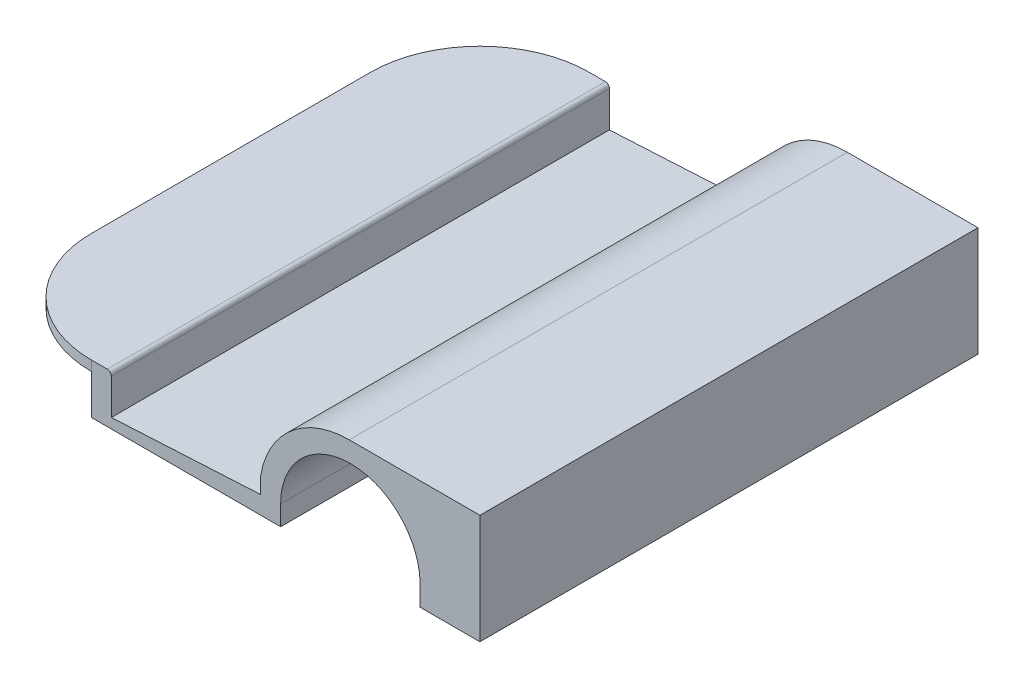
from build123d import *

# Parameters (mm, degrees)
BOSS_EXTRU_1_DEPTH = 250
CONG_1_R           = 55
CONG_2_R           = 2


with BuildPart() as part:
    # Esquisse1 → Boss.-Extru.1 (new body)
    with BuildSketch(Plane.XY):
        with BuildLine():
            Line((0, 0), (55, 0))
            Line((55, 0), (55, -20))
            Line((55, -20), (150, -20))
            Line((150, -20), (150, -10))
            ThreePointArc((150, -10), (185, 25), (220, -10))
            Line((220, -10), (220, -20))
            Line((220, -20), (250, -20))
            Line((250, -20), (250, 35))
            Line((250, 35), (184.403047163, 35))
            ThreePointArc((184.403047163, 35), (155.280415441, 24.305572748), (140, -2.694563485))
            Line((140, -2.694563485), (140, -11))
            Line((140, -11), (65, -15))
            Line((65, -15), (65, 5))
            Line((65, 5), (0, 5))
            Line((0, 5), (0, 0))
        make_face()
    extrude(amount=BOSS_EXTRU_1_DEPTH)

    # Congé1
    cong_1_edges = [part.edges().sort_by_distance(p)[0] for p in [
        (0, 2.5, 0),
        (0, 2.5, 250),
    ]]
    fillet(cong_1_edges, radius=CONG_1_R)

    # Congé2
    cong_2_edges = [part.edges().sort_by_distance(p)[0] for p in [
        (65, 5, 125),
    ]]
    fillet(cong_2_edges, radius=CONG_2_R)


solid = part.part
